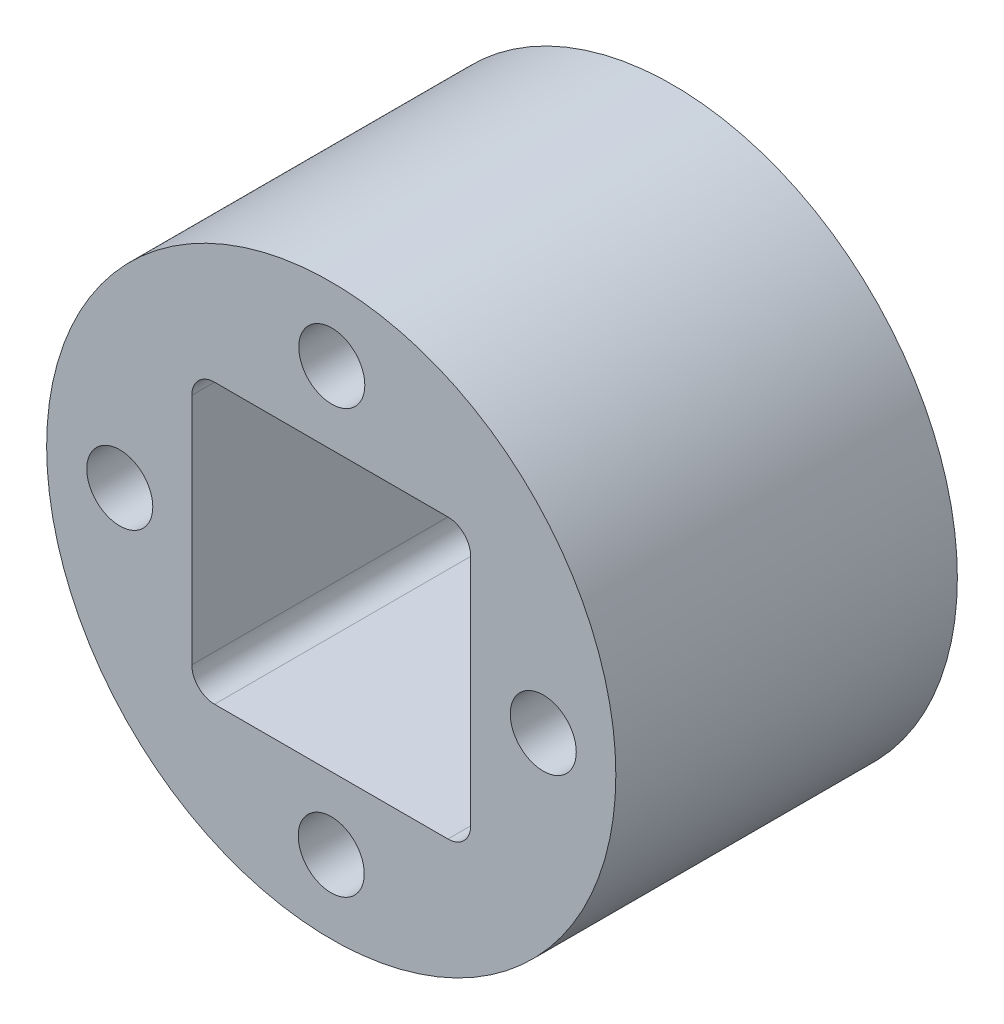
from build123d import *

# Parameters (mm, degrees)
SKETCH1_R           = 12.5
BOSS_EXTRUDE1_DEPTH = 7.5
CUT_EXTRUDE3_REACH  = 25.184
SKETCH8_W           = 12.25
SKETCH8_H           = 12.25
SKETCH9_R           = 1.45
CUT_EXTRUDE4_DEPTH  = 10
FILLET1_R           = 1


with BuildPart() as part:
    # Sketch1 → Boss-Extrude1 (new, symmetric)
    with BuildSketch(Plane.XY):
        Circle(SKETCH1_R)
    extrude(amount=BOSS_EXTRUDE1_DEPTH, both=True)

    # Sketch8 → Cut-Extrude3 (cut, up to next)
    with BuildSketch(Plane.XY.offset(7.5), mode=Mode.PRIVATE) as cut_extrude3_sk1:
        Rectangle(SKETCH8_W, SKETCH8_H)
    cut_extrude3_tool1 = extrude(cut_extrude3_sk1.sketch, amount=-CUT_EXTRUDE3_REACH, mode=Mode.PRIVATE) & part.part
    add(cut_extrude3_tool1.solids().sort_by_distance((0, 0, 7.5))[0], mode=Mode.SUBTRACT)

    # Sketch9 → Cut-Extrude4 (cut)
    with BuildSketch(Plane.XY.offset(7.5)):
        with Locations((9.3125, 0)):
            Circle(SKETCH9_R)
        with Locations((0, -9.2875)):
            Circle(SKETCH9_R)
        with Locations((-9.2875, 0.025)):
            Circle(SKETCH9_R)
        with Locations((0.025, 9.3125)):
            Circle(SKETCH9_R)
    extrude(amount=-CUT_EXTRUDE4_DEPTH, mode=Mode.SUBTRACT)

    # Fillet1
    fillet1_edges = [part.edges().sort_by_distance(p)[0] for p in [
        (6.125, 6.125, 0),
        (6.125, -6.125, 0),
        (-6.125, -6.125, 0),
        (-6.125, 6.125, 0),
    ]]
    fillet(fillet1_edges, radius=FILLET1_R)


solid = part.part
